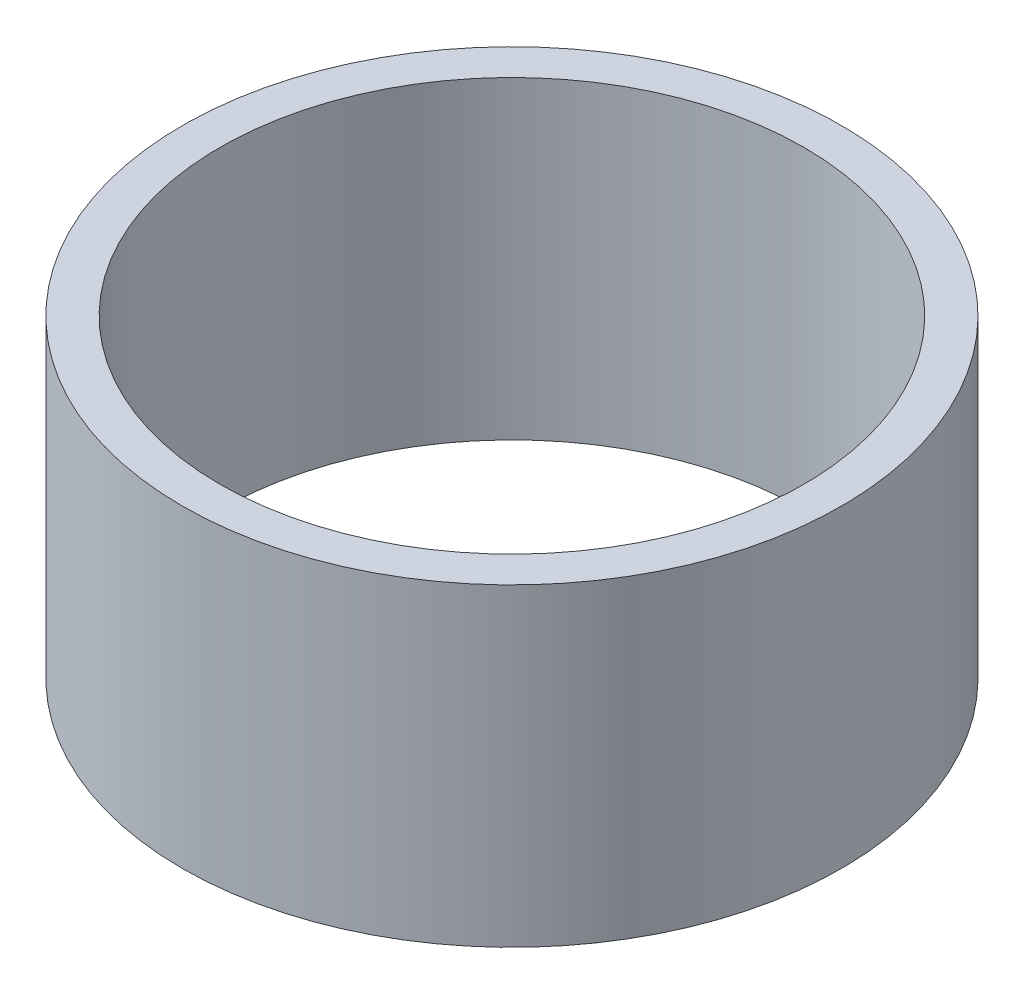
from build123d import *

# Parameters (mm, degrees)
IZIM1_R                     = 52.5
IZIM1_R_2                   = 46.5
Y_KSEKLIK_EKSTR_ZYON1_DEPTH = 50


with BuildPart() as part:
    # Çizim1 → Yükseklik-Ekstrüzyon1 (new body)
    with BuildSketch(Plane(origin=(0, 0, 0), x_dir=(1, 0, 0), z_dir=(0, 1, 0))):
        with Locations(Location((0, 0, 0), (0, 0, 270))):
            Circle(IZIM1_R)
        with Locations(Location((0, 0, 0), (0, 0, 270))):
            Circle(IZIM1_R_2, mode=Mode.SUBTRACT)
    extrude(amount=Y_KSEKLIK_EKSTR_ZYON1_DEPTH)


solid = part.part
